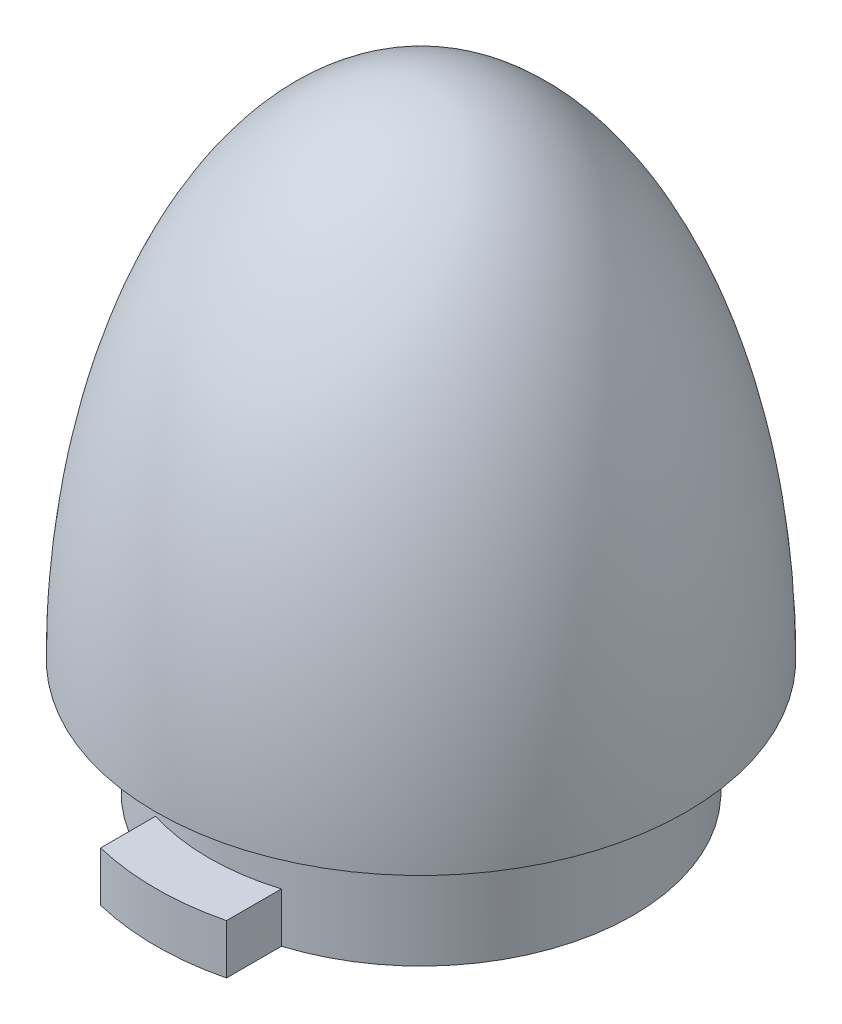
from build123d import *

# Parameters (mm, degrees)
BOSS_EXTRUDE1_START = 2.54
BOSS_EXTRUDE1_DEPTH = 1.905


with BuildPart() as part:
    # Sketch1 → Revolve1 (revolve)
    with BuildSketch(Plane(origin=(0, 0, 0), x_dir=(0, 0, -1), z_dir=(1, 0, 0)), mode=Mode.PRIVATE) as revolve1_sk:
        with BuildLine():
            Line((-8.128, 0), (-8.128, 4.445))
            Line((-8.128, 4.445), (-10.16, 4.445))
            add(Edge.make_bspline(
                [(0, 23.495), (-10.16, 23.495), (-10.16, 4.445)],
                knots=[3.141592654, 3.141592654, 3.141592654, 4.71238898, 4.71238898, 4.71238898], degree=2, weights=[1, 0.707106781, 1]))
            Line((0, 23.495), (0, 21.463))
            add(Edge.make_bspline(
                [(0, 21.463), (-0.398270959, 21.463), (-1.153389942, 21.335826731), (-2.429445225, 20.684705062), (-3.759980482, 19.474733116), (-5.045566653, 17.699172098), (-6.18547282, 15.416687429), (-7.108495403, 12.712906185), (-7.763293706, 9.707759052), (-8.001641772, 7.545168518), (-8.066508555, 6.477)],
                knots=[3.141592654, 3.141592654, 3.141592654, 3.141592654, 3.323770314, 3.505947975, 3.688125635, 3.870303296, 4.052480956, 4.234658617, 4.416836277, 4.599013938, 4.599013938, 4.599013938, 4.599013938], degree=3))
            Line((-8.066508555, 6.477), (-6.096, 6.477))
            Line((-6.096, 6.477), (-6.096, 0))
            Line((-6.096, 0), (-8.128, 0))
        make_face()
    revolve(revolve1_sk.sketch.rotate(Axis((0, 0, 0), (0, 1, 0)), 180), axis=Axis((0, 0, 0), (0, 1, 0)))

    # Sketch2 → Boss-Extrude1 (add)
    with BuildSketch(Plane.XZ.offset(-4.445).offset(BOSS_EXTRUDE1_START)):
        with BuildLine():
            Line((-2.413, 9.869297391), (-2.413, 7.761560088))
            ThreePointArc((-2.413, 7.761560088), (0, 8.128), (2.413, 7.761560088))
            Line((2.413, 7.761560088), (2.413, 9.869297391))
            ThreePointArc((2.413, 9.869297391), (0, 10.16), (-2.413, 9.869297391))
        make_face()
        with BuildLine():
            Line((2.413, -9.869297391), (2.413, -7.761560088))
            ThreePointArc((2.413, -7.761560088), (0, -8.128), (-2.413, -7.761560088))
            Line((-2.413, -7.761560088), (-2.413, -9.869297391))
            ThreePointArc((-2.413, -9.869297391), (0, -10.16), (2.413, -9.869297391))
        make_face()
    extrude(amount=BOSS_EXTRUDE1_DEPTH)


solid = part.part
